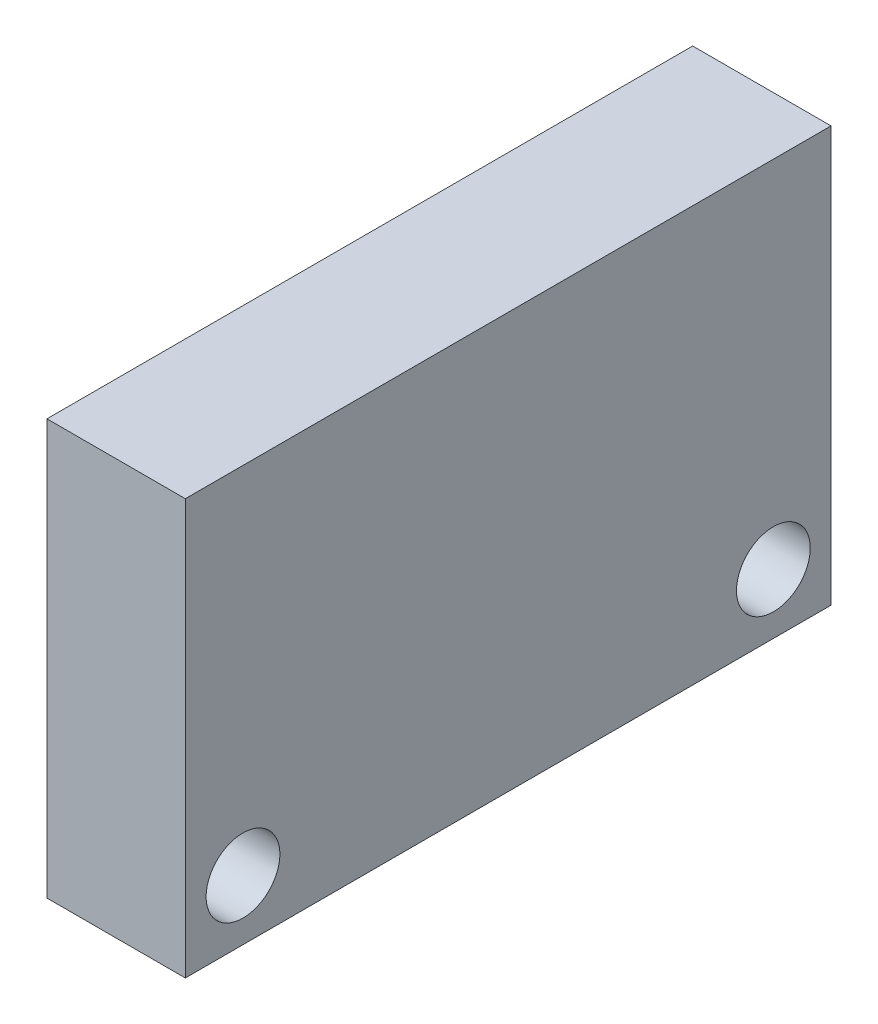
from build123d import *

# Parameters (mm, degrees)
ESQUISSE1_W             = 6
ESQUISSE1_H             = 18
BOSS_EXTRU_1_DEPTH      = 28
ESQUISSE2_R             = 1.6
ENL_V_MAT_EXTRU_1_DEPTH = 28


with BuildPart() as part:
    # Esquisse1 → Boss.-Extru.1 (new body)
    with BuildSketch(Plane.XY):
        Rectangle(ESQUISSE1_W, ESQUISSE1_H)
    extrude(amount=BOSS_EXTRU_1_DEPTH)

    # Esquisse2 → Enlèv. mat.-Extru.1 (cut)
    with BuildSketch(Plane.ZY.offset(3)):
        with Locations((2.5, -6.4)):
            Circle(ESQUISSE2_R)
        with Locations((25.5, -6.4)):
            Circle(ESQUISSE2_R)
    extrude(amount=-ENL_V_MAT_EXTRU_1_DEPTH, mode=Mode.SUBTRACT)


solid = part.part
